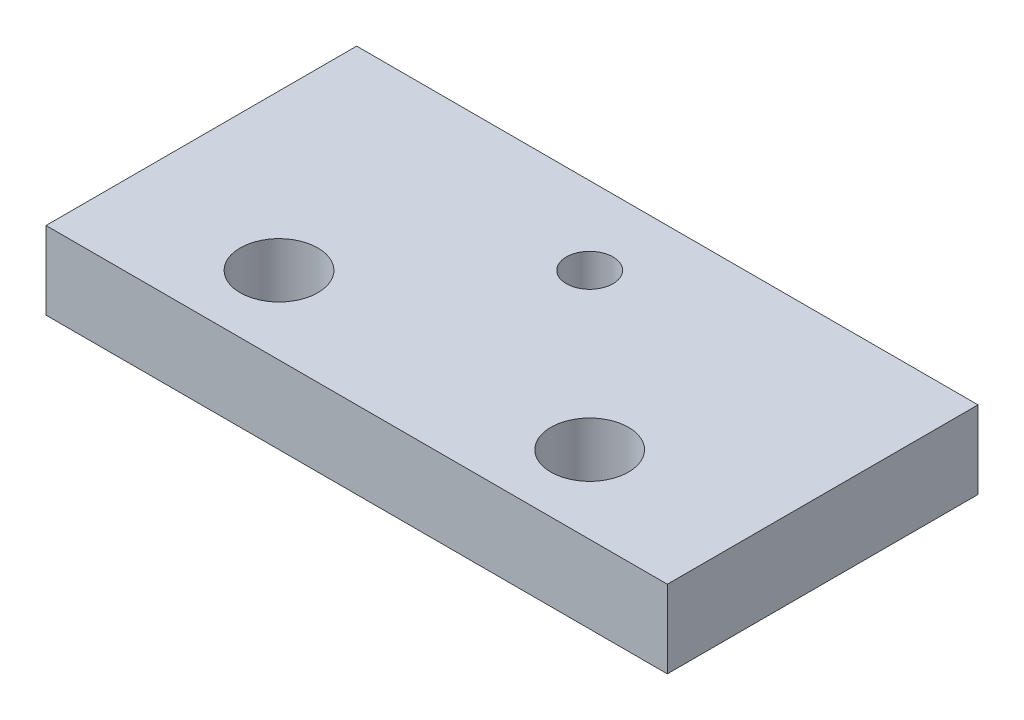
from build123d import *

# Parameters (mm, degrees)
SKETCH1_W           = 25.4
SKETCH1_H           = 12.7
BOSS_EXTRUDE1_DEPTH = 3.175
SKETCH2_R           = 1.5875
SKETCH2_R_2         = 0.9525
CUT_EXTRUDE1_DEPTH  = 29.575


with BuildPart() as part:
    # Sketch1 → Boss-Extrude1 (new body)
    with BuildSketch(Plane(origin=(0, 0, 0), x_dir=(1, 0, 0), z_dir=(0, 1, 0))):
        with Locations((12.7, 6.35)):
            Rectangle(SKETCH1_W, SKETCH1_H)
    extrude(amount=BOSS_EXTRUDE1_DEPTH)

    # Sketch2 → Cut-Extrude1 (cut, through all)
    with BuildSketch(Plane(origin=(0, 3.175, 0), x_dir=(1, 0, 0), z_dir=(0, 1, 0))):
        with Locations(Location((19.05, 3.175, 0), (0, 0, 270))):
            Circle(SKETCH2_R)
        with Locations(Location((6.35, 3.175, 0), (0, 0, 90))):
            Circle(SKETCH2_R)
        with Locations(Location((12.7, 9.525, 0), (0, 0, 270))):
            Circle(SKETCH2_R_2)
    extrude(amount=-CUT_EXTRUDE1_DEPTH, mode=Mode.SUBTRACT)


solid = part.part
